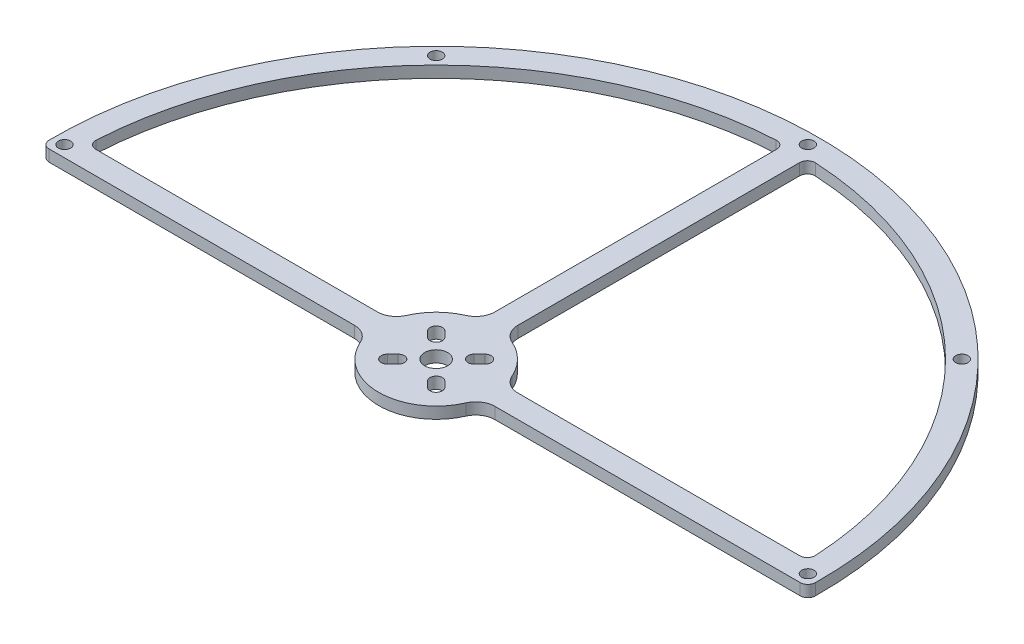
from build123d import *

# Parameters (mm, degrees)
SKETCH_1_R      = 1.6
SKETCH_1_R_2    = 3
EXTRUDE_1_DEPTH = 3


with BuildPart() as part:
    # 草图1 → 凸台-拉伸1 (new body)
    with BuildSketch(Plane(origin=(0, 0, 0), x_dir=(1, 0, 0), z_dir=(0, 1, 0))):
        with BuildLine():
            Line((-97.894892614, -3), (-18.33030278, -3))
            ThreePointArc((-18.33030278, -3), (-15.591689992, -3.816699867), (-13.747727085, -6))
            ThreePointArc((-13.747727085, -6), (0, -15), (13.747727085, -6))
            ThreePointArc((13.747727085, -6), (15.591689992, -3.816699867), (18.33030278, -3))
            Line((18.33030278, -3), (97.894892614, -3))
            ThreePointArc((97.894892614, -3), (99.301864892, -2.421417957), (99.894788276, -1.020429009))
            ThreePointArc((99.894788276, -1.020429009), (0, 99.9), (-99.894788276, -1.020429009))
            ThreePointArc((-99.894788276, -1.020429009), (-99.301864892, -2.421417957), (-97.894892614, -3))
        make_face()
        with Locations(Location((0, 96.9, 0), (0, 0, 270))):
            Circle(SKETCH_1_R, mode=Mode.SUBTRACT)
        with Locations(Location((68.518647097, 68.518647097, 0), (0, 0, 270))):
            Circle(SKETCH_1_R, mode=Mode.SUBTRACT)
        with Locations(Location((96.9, 0, 0), (0, 0, 270))):
            Circle(SKETCH_1_R, mode=Mode.SUBTRACT)
        with Locations(Location((-96.9, 0, 0), (0, 0, 270))):
            Circle(SKETCH_1_R, mode=Mode.SUBTRACT)
        with Locations(Location((-68.518647097, 68.518647097, 0), (0, 0, 270))):
            Circle(SKETCH_1_R, mode=Mode.SUBTRACT)
        with Locations(Location((0, 0, 0), (0, 0, 270))):
            Circle(SKETCH_1_R_2, mode=Mode.SUBTRACT)
        with BuildLine():
            Line((6.081118318, -3.818376618), (7.495331881, -5.232590181))
            ThreePointArc((7.495331881, -5.232590181), (7.495331881, -7.495331881), (5.232590181, -7.495331881))
            Line((5.232590181, -7.495331881), (3.818376618, -6.081118318))
            ThreePointArc((3.818376618, -6.081118318), (3.818376618, -3.818376618), (6.081118318, -3.818376618))
        make_face(mode=Mode.SUBTRACT)
        with BuildLine():
            Line((-3.818376618, -6.081118318), (-5.232590181, -7.495331881))
            ThreePointArc((-5.232590181, -7.495331881), (-7.495331881, -7.495331881), (-7.495331881, -5.232590181))
            Line((-7.495331881, -5.232590181), (-6.081118318, -3.818376618))
            ThreePointArc((-6.081118318, -3.818376618), (-3.818376618, -3.818376618), (-3.818376618, -6.081118318))
        make_face(mode=Mode.SUBTRACT)
        with BuildLine():
            Line((-6.081118318, 3.818376618), (-7.495331881, 5.232590181))
            ThreePointArc((-7.495331881, 5.232590181), (-7.495331881, 7.495331881), (-5.232590181, 7.495331881))
            Line((-5.232590181, 7.495331881), (-3.818376618, 6.081118318))
            ThreePointArc((-3.818376618, 6.081118318), (-3.818376618, 3.818376618), (-6.081118318, 3.818376618))
        make_face(mode=Mode.SUBTRACT)
        with BuildLine():
            Line((3.818376618, 6.081118318), (5.232590181, 7.495331881))
            ThreePointArc((5.232590181, 7.495331881), (7.495331881, 7.495331881), (7.495331881, 5.232590181))
            Line((7.495331881, 5.232590181), (6.081118318, 3.818376618))
            ThreePointArc((6.081118318, 3.818376618), (3.818376618, 3.818376618), (3.818376618, 6.081118318))
        make_face(mode=Mode.SUBTRACT)
        with BuildLine():
            Line((-91.763881784, 3), (-18.33030278, 3))
            ThreePointArc((-18.33030278, 3), (-15.591689992, 3.816699867), (-13.747727085, 6))
            ThreePointArc((-13.747727085, 6), (-10.606601718, 10.606601718), (-6, 13.747727085))
            ThreePointArc((-6, 13.747727085), (-3.816699867, 15.591689992), (-3, 18.33030278))
            Line((-3, 18.33030278), (-3, 91.763881784))
            ThreePointArc((-3, 91.763881784), (-3.624795989, 93.216057368), (-5.108813928, 93.760919472))
            ThreePointArc((-5.108813928, 93.760919472), (-66.397326753, 66.397326753), (-93.760919472, 5.108813928))
            ThreePointArc((-93.760919472, 5.108813928), (-93.216057368, 3.624795989), (-91.763881784, 3))
        make_face(mode=Mode.SUBTRACT)
        with BuildLine():
            Line((3, 18.33030278), (3, 91.763881784))
            ThreePointArc((3, 91.763881784), (3.624795989, 93.216057368), (5.108813928, 93.760919472))
            ThreePointArc((5.108813928, 93.760919472), (66.397326753, 66.397326753), (93.760919472, 5.108813928))
            ThreePointArc((93.760919472, 5.108813928), (93.216057368, 3.624795989), (91.763881784, 3))
            Line((91.763881784, 3), (18.33030278, 3))
            ThreePointArc((18.33030278, 3), (15.591689992, 3.816699867), (13.747727085, 6))
            ThreePointArc((13.747727085, 6), (10.606601718, 10.606601718), (6, 13.747727085))
            ThreePointArc((6, 13.747727085), (3.816699867, 15.591689992), (3, 18.33030278))
        make_face(mode=Mode.SUBTRACT)
    extrude(amount=EXTRUDE_1_DEPTH)


solid = part.part
